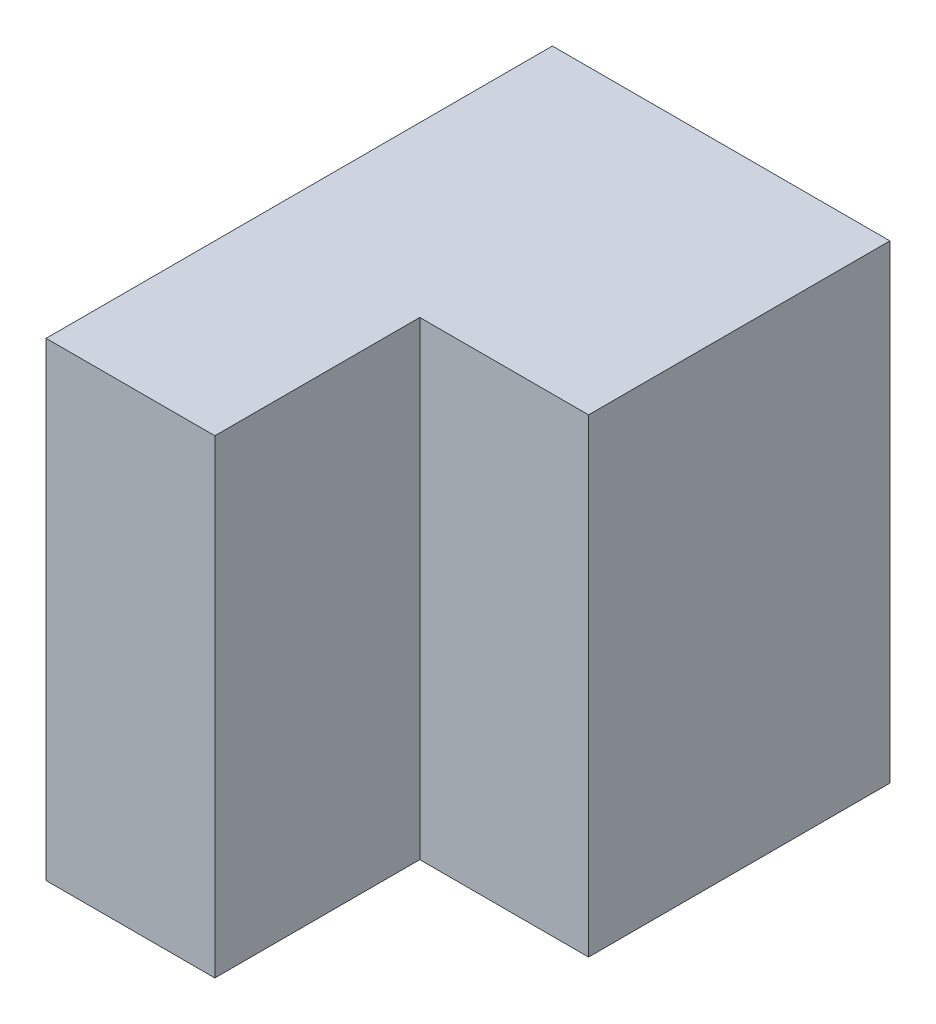
from build123d import *

# Parameters (mm, degrees)
SKETCH1_W           = 15
SKETCH1_H           = 13.912895938
BOSS_EXTRUDE1_DEPTH = 10
SKETCH2_W           = 6.071631059
SKETCH2_H           = 13.912895938
CUT_EXTRUDE1_DEPTH  = 5


with BuildPart() as part:
    # Sketch1 → Boss-Extrude1 (new body)
    with BuildSketch(Plane(origin=(0, 0, 0), x_dir=(0, 0, -1), z_dir=(1, 0, 0))):
        with Locations((7.5, 6.956447969)):
            Rectangle(SKETCH1_W, SKETCH1_H)
    extrude(amount=BOSS_EXTRUDE1_DEPTH)

    # Sketch2 → Cut-Extrude1 (cut)
    with BuildSketch(Plane(origin=(10, 0, 0), x_dir=(0, 0, -1), z_dir=(1, 0, 0))):
        with Locations((3.03581553, 6.956447969)):
            Rectangle(SKETCH2_W, SKETCH2_H)
    extrude(amount=-CUT_EXTRUDE1_DEPTH, mode=Mode.SUBTRACT)


solid = part.part
